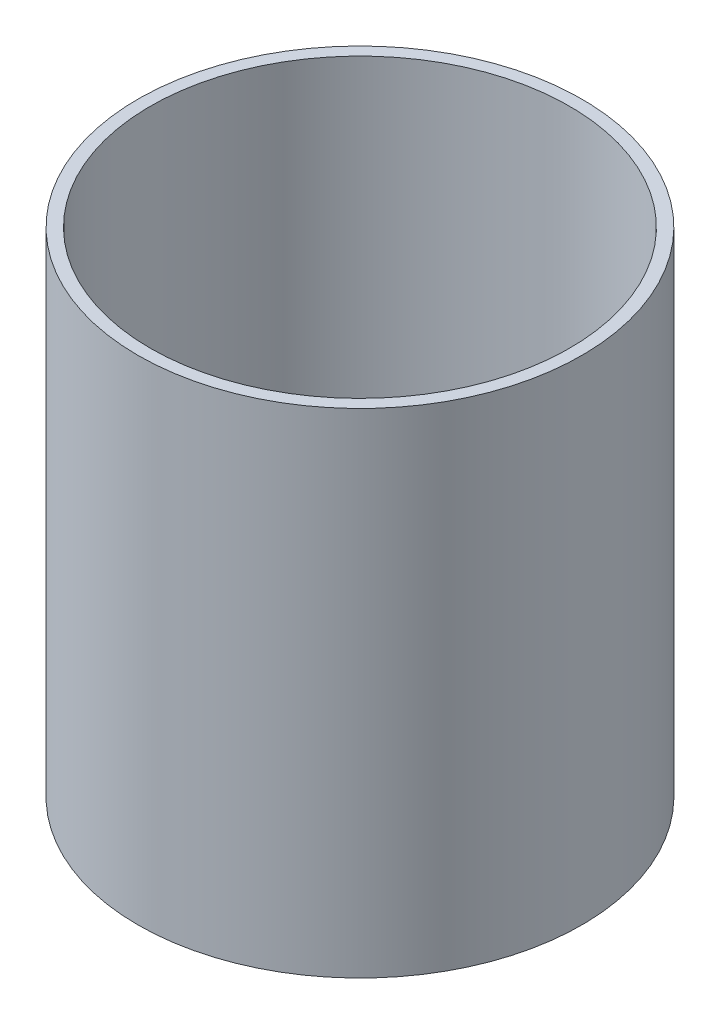
from build123d import *

# Parameters (mm, degrees)
SKETCH1_R           = 22.5
SKETCH1_R_2         = 21.25
BOSS_EXTRUDE1_DEPTH = 50


with BuildPart() as part:
    # Sketch1 → Boss-Extrude1 (new body)
    with BuildSketch(Plane(origin=(0, 0, 0), x_dir=(1, 0, 0), z_dir=(0, 1, 0))):
        with Locations(Location((0, 0, 0), (0, 0, 270))):
            Circle(SKETCH1_R)
        with Locations(Location((0, 0, 0), (0, 0, 270))):
            Circle(SKETCH1_R_2, mode=Mode.SUBTRACT)
    extrude(amount=BOSS_EXTRUDE1_DEPTH)


solid = part.part
